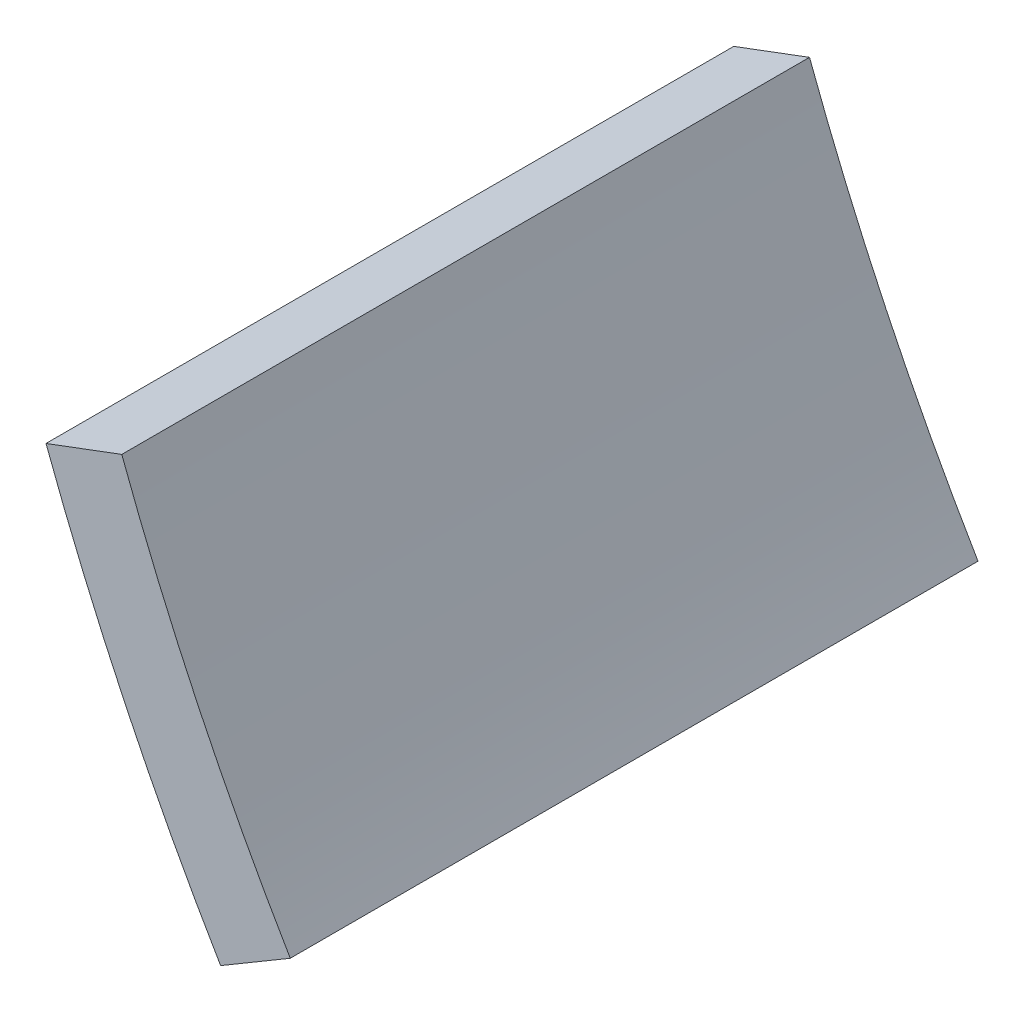
from build123d import *

# Parameters (mm, degrees)
BOSS_EXTRU_1_DEPTH = 17


with BuildPart() as part:
    # Esquisse1 → Boss.-Extru.1 (new body)
    with BuildSketch(Plane.XY):
        with BuildLine():
            Line((-51.504026949, -19.295989428), (-53.376900657, -19.997661771))
            ThreePointArc((-53.376900657, -19.997661771), (-51.416964271, -24.602759707), (-49.060627024, -29.018181818))
            Line((-49.060627024, -29.018181818), (-47.339201514, -28))
            ThreePointArc((-47.339201514, -28), (-49.612860261, -23.73950498), (-51.504026949, -19.295989428))
        make_face()
    extrude(amount=BOSS_EXTRU_1_DEPTH)


solid = part.part
